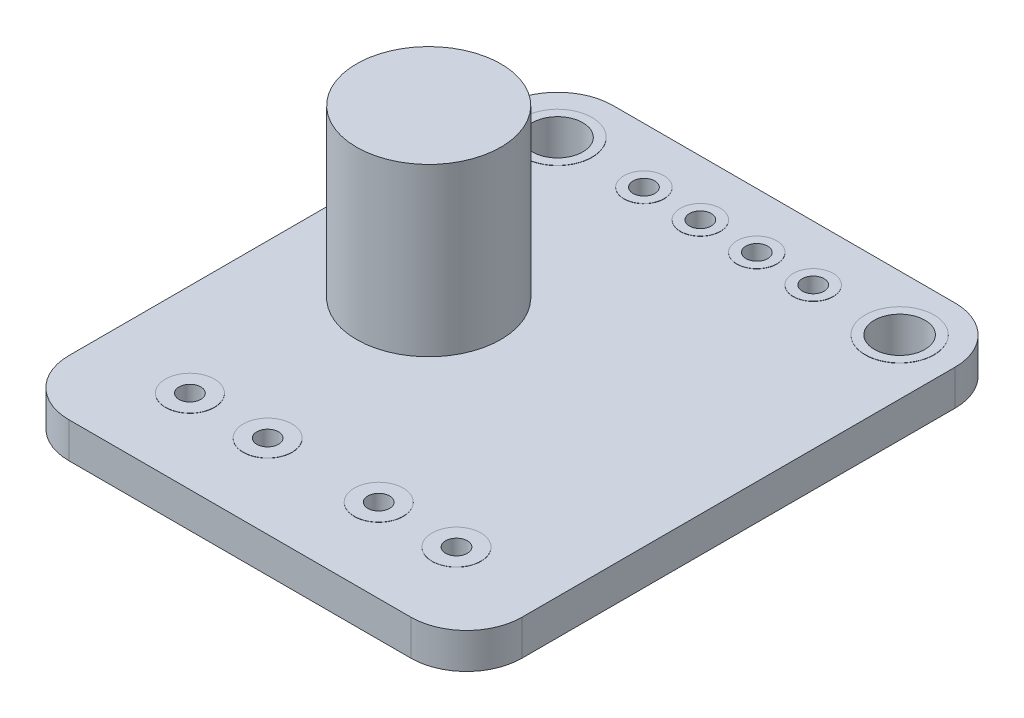
from build123d import *

# Parameters (mm, degrees)
SKETCH1_R           = 1.15
SKETCH1_R_2         = 0.5
BOSS_EXTRUDE1_DEPTH = 1.6
SKETCH2_R           = 1.55
SKETCH2_R_2         = 1.14
SKETCH2_R_3         = 0.9
SKETCH2_R_4         = 0.49
SKETCH2_R_5         = 1.1
BOSS_EXTRUDE2_DEPTH = 1.62
SKETCH3_R           = 3.25
BOSS_EXTRUDE3_DEPTH = 7.5


with BuildPart() as part:
    # Sketch1 → Boss-Extrude1 (new body)
    with BuildSketch(Plane(origin=(0, 0, 0), x_dir=(1, 0, 0), z_dir=(0, 1, 0))):
        with BuildLine():
            Line((-7.7, 12.25), (7.7, 12.25))
            ThreePointArc((7.7, 12.25), (9.467766953, 11.517766953), (10.2, 9.75))
            Line((10.2, 9.75), (10.2, -9.75))
            ThreePointArc((10.2, -9.75), (9.467766953, -11.517766953), (7.7, -12.25))
            Line((7.7, -12.25), (-7.7, -12.25))
            ThreePointArc((-7.7, -12.25), (-9.467766953, -11.517766953), (-10.2, -9.75))
            Line((-10.2, -9.75), (-10.2, 9.75))
            ThreePointArc((-10.2, 9.75), (-9.467766953, 11.517766953), (-7.7, 12.25))
        make_face()
        with Locations(Location((-7.7, 9.75, 0), (0, 0, 270))):
            Circle(SKETCH1_R, mode=Mode.SUBTRACT)
        with Locations(Location((7.7, 9.75, 0), (0, 0, 270))):
            Circle(SKETCH1_R, mode=Mode.SUBTRACT)
        with Locations(Location((-3.81, 9.75, 0), (0, 0, 270))):
            Circle(SKETCH1_R_2, mode=Mode.SUBTRACT)
        with Locations(Location((-1.27, 9.75, 0), (0, 0, 270))):
            Circle(SKETCH1_R_2, mode=Mode.SUBTRACT)
        with Locations(Location((1.27, 9.75, 0), (0, 0, 270))):
            Circle(SKETCH1_R_2, mode=Mode.SUBTRACT)
        with Locations(Location((3.81, 9.75, 0), (0, 0, 270))):
            Circle(SKETCH1_R_2, mode=Mode.SUBTRACT)
        with Locations(Location((-6, -8.5, 0), (0, 0, 270))):
            Circle(SKETCH1_R_2, mode=Mode.SUBTRACT)
        with Locations(Location((-2.5, -8.5, 0), (0, 0, 270))):
            Circle(SKETCH1_R_2, mode=Mode.SUBTRACT)
        with Locations(Location((6, -8.5, 0), (0, 0, 90))):
            Circle(SKETCH1_R_2, mode=Mode.SUBTRACT)
        with Locations(Location((2.5, -8.5, 0), (0, 0, 90))):
            Circle(SKETCH1_R_2, mode=Mode.SUBTRACT)
    extrude(amount=BOSS_EXTRUDE1_DEPTH)

    # Sketch2 → Boss-Extrude2 (add)
    # profile 1 of 10: a face of its own
    with BuildSketch(Plane(origin=(0, 1.61, 0), x_dir=(1, 0, 0), z_dir=(0, 1, 0))):
        with Locations(Location((7.7, 9.75, 0), (0, 0, 270))):
            Circle(SKETCH2_R)
        with Locations(Location((7.7, 9.75, 0), (0, 0, 270))):
            Circle(SKETCH2_R_2, mode=Mode.SUBTRACT)
    # profile 2 of 10: a face of its own
    with BuildSketch(Plane(origin=(0, 1.61, 0), x_dir=(1, 0, 0), z_dir=(0, 1, 0))):
        with Locations(Location((3.81, 9.75, 0), (0, 0, 270))):
            Circle(SKETCH2_R_3)
        with Locations(Location((3.81, 9.75, 0), (0, 0, 270))):
            Circle(SKETCH2_R_4, mode=Mode.SUBTRACT)
    # profile 3 of 10: a face of its own
    with BuildSketch(Plane(origin=(0, 1.61, 0), x_dir=(1, 0, 0), z_dir=(0, 1, 0))):
        with Locations(Location((1.27, 9.75, 0), (0, 0, 270))):
            Circle(SKETCH2_R_3)
        with Locations(Location((1.27, 9.75, 0), (0, 0, 270))):
            Circle(SKETCH2_R_4, mode=Mode.SUBTRACT)
    # profile 4 of 10: a face of its own
    with BuildSketch(Plane(origin=(0, 1.61, 0), x_dir=(1, 0, 0), z_dir=(0, 1, 0))):
        with Locations(Location((-1.27, 9.75, 0), (0, 0, 270))):
            Circle(SKETCH2_R_3)
        with Locations(Location((-1.27, 9.75, 0), (0, 0, 270))):
            Circle(SKETCH2_R_4, mode=Mode.SUBTRACT)
    # profile 5 of 10: a face of its own
    with BuildSketch(Plane(origin=(0, 1.61, 0), x_dir=(1, 0, 0), z_dir=(0, 1, 0))):
        with Locations(Location((-3.81, 9.75, 0), (0, 0, 270))):
            Circle(SKETCH2_R_3)
        with Locations(Location((-3.81, 9.75, 0), (0, 0, 270))):
            Circle(SKETCH2_R_4, mode=Mode.SUBTRACT)
    # profile 6 of 10: a face of its own
    with BuildSketch(Plane(origin=(0, 1.61, 0), x_dir=(1, 0, 0), z_dir=(0, 1, 0))):
        with Locations(Location((-7.7, 9.75, 0), (0, 0, 270))):
            Circle(SKETCH2_R)
        with Locations(Location((-7.7, 9.75, 0), (0, 0, 270))):
            Circle(SKETCH2_R_2, mode=Mode.SUBTRACT)
    # profile 7 of 10: a face of its own
    with BuildSketch(Plane(origin=(0, 1.61, 0), x_dir=(1, 0, 0), z_dir=(0, 1, 0))):
        with Locations(Location((-6, -8.5, 0), (0, 0, 270))):
            Circle(SKETCH2_R_5)
        with Locations(Location((-6, -8.5, 0), (0, 0, 270))):
            Circle(SKETCH2_R_4, mode=Mode.SUBTRACT)
    # profile 8 of 10: a face of its own
    with BuildSketch(Plane(origin=(0, 1.61, 0), x_dir=(1, 0, 0), z_dir=(0, 1, 0))):
        with Locations(Location((-2.5, -8.5, 0), (0, 0, 270))):
            Circle(SKETCH2_R_5)
        with Locations(Location((-2.5, -8.5, 0), (0, 0, 270))):
            Circle(SKETCH2_R_4, mode=Mode.SUBTRACT)
    # profile 9 of 10: a face of its own
    with BuildSketch(Plane(origin=(0, 1.61, 0), x_dir=(1, 0, 0), z_dir=(0, 1, 0))):
        with Locations(Location((2.5, -8.5, 0), (0, 0, 270))):
            Circle(SKETCH2_R_5)
        with Locations(Location((2.5, -8.5, 0), (0, 0, 270))):
            Circle(SKETCH2_R_4, mode=Mode.SUBTRACT)
    # profile 10 of 10: a face of its own
    with BuildSketch(Plane(origin=(0, 1.61, 0), x_dir=(1, 0, 0), z_dir=(0, 1, 0))):
        with Locations(Location((6, -8.5, 0), (0, 0, 270))):
            Circle(SKETCH2_R_5)
        with Locations(Location((6, -8.5, 0), (0, 0, 270))):
            Circle(SKETCH2_R_4, mode=Mode.SUBTRACT)
    extrude(amount=-BOSS_EXTRUDE2_DEPTH)

    # Sketch3 → Boss-Extrude3 (add)
    with BuildSketch(Plane(origin=(0, 1.6, 0), x_dir=(1, 0, 0), z_dir=(0, 1, 0))):
        with Locations(Location((-4.35038, 0.6, 0), (0, 0, 270))):
            Circle(SKETCH3_R)
    extrude(amount=BOSS_EXTRUDE3_DEPTH)


solid = part.part
